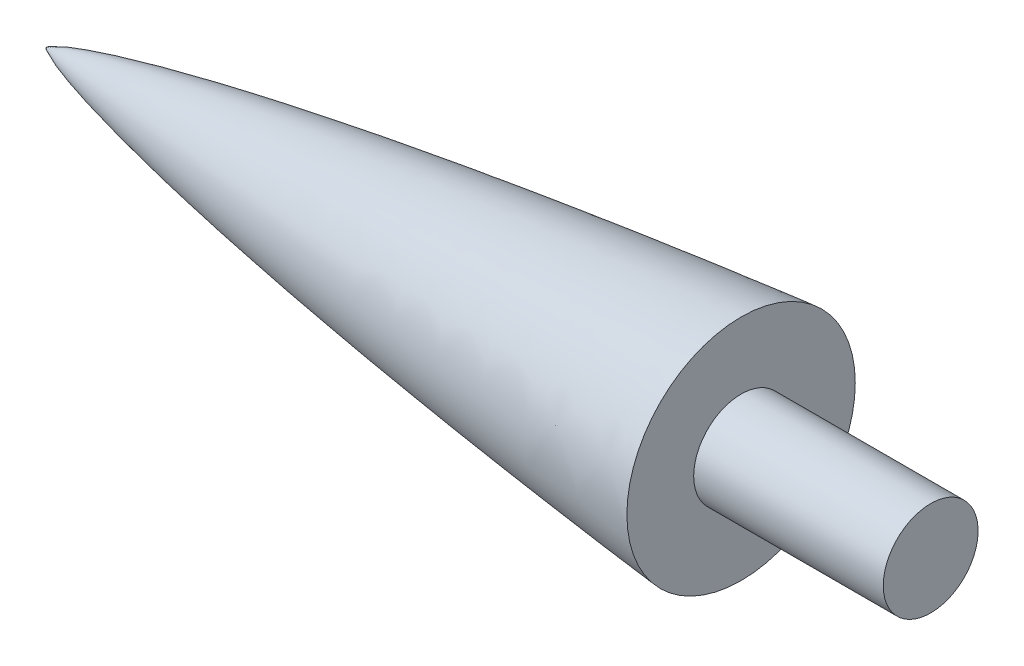
from build123d import *


with BuildPart() as part:
    # Sketch1 → Revolve1 (revolve)
    with BuildSketch(Plane(origin=(0, 0, 0), x_dir=(1, 0, 0), z_dir=(0, 1, 0)), mode=Mode.PRIVATE) as revolve1_sk:
        with BuildLine():
            Line((0, 0), (237, 0))
            Line((237, 0), (237, 12.7))
            Line((237, 12.7), (186.200000001, 12.7))
            Line((186.200000001, 12.7), (186.200000001, 30.594170705))
            add(Edge.make_bspline(
                [(0, 0), (0.003108824, 0.008877464), (0.011075213, 0.0257359), (0.033792547, 0.055867688), (0.070057341, 0.095169349), (0.114237308, 0.136257231), (0.178077987, 0.189836562), (0.265098069, 0.255901112), (0.394881665, 0.345155619), (0.606995268, 0.476664104), (0.952068498, 0.668617104), (1.540180436, 0.959829813), (2.574071413, 1.411637301), (4.413924683, 2.114882781), (7.602367512, 3.173855716), (13.106458647, 4.759202765), (21.440375249, 6.833779879), (32.22233195, 9.185149098), (44.848393584, 11.645523212), (58.226037573, 14.019641235), (69.956416764, 15.944741522), (80.02643725, 17.505951568), (90.103776447, 19.003577807), (100.194023174, 20.442838662), (110.28522026, 21.814800154), (120.397645134, 23.128713291), (128.810678564, 24.184880712), (134.732708793, 24.908781709), (139.753375696, 25.510861346), (144.877547535, 26.113408572), (149.811116787, 26.686979635), (155.948282857, 27.380709793), (162.343077765, 28.092820391), (169.640854593, 28.878155459), (175.520193146, 29.503376876), (181.664721368, 30.134568669), (184.66240707, 30.439257875), (186.200000001, 30.594170705)],
                knots=[0, 0, 0, 0, 0, 0.000180113, 0.000360226, 0.000720451, 0.001029914, 0.001339376, 0.001964108, 0.002821975, 0.004060083, 0.006140497, 0.009560315, 0.015446565, 0.025765671, 0.044032448, 0.074196861, 0.125648084, 0.191010151, 0.256372222, 0.321734286, 0.387096355, 0.419777389, 0.452458422, 0.51782049, 0.583182557, 0.615863591, 0.648544625, 0.681225659, 0.697566176, 0.713906692, 0.746587726, 0.77926876, 0.811949794, 0.844630827, 0.877311861, 0.909992895, 0.909992895, 0.909992895, 0.909992895, 0.909992895], degree=4))
        make_face()
    revolve(revolve1_sk.sketch.rotate(Axis((0, 0, 0), (1, 0, 0)), 180), axis=Axis((0, 0, 0), (1, 0, 0)))


solid = part.part
